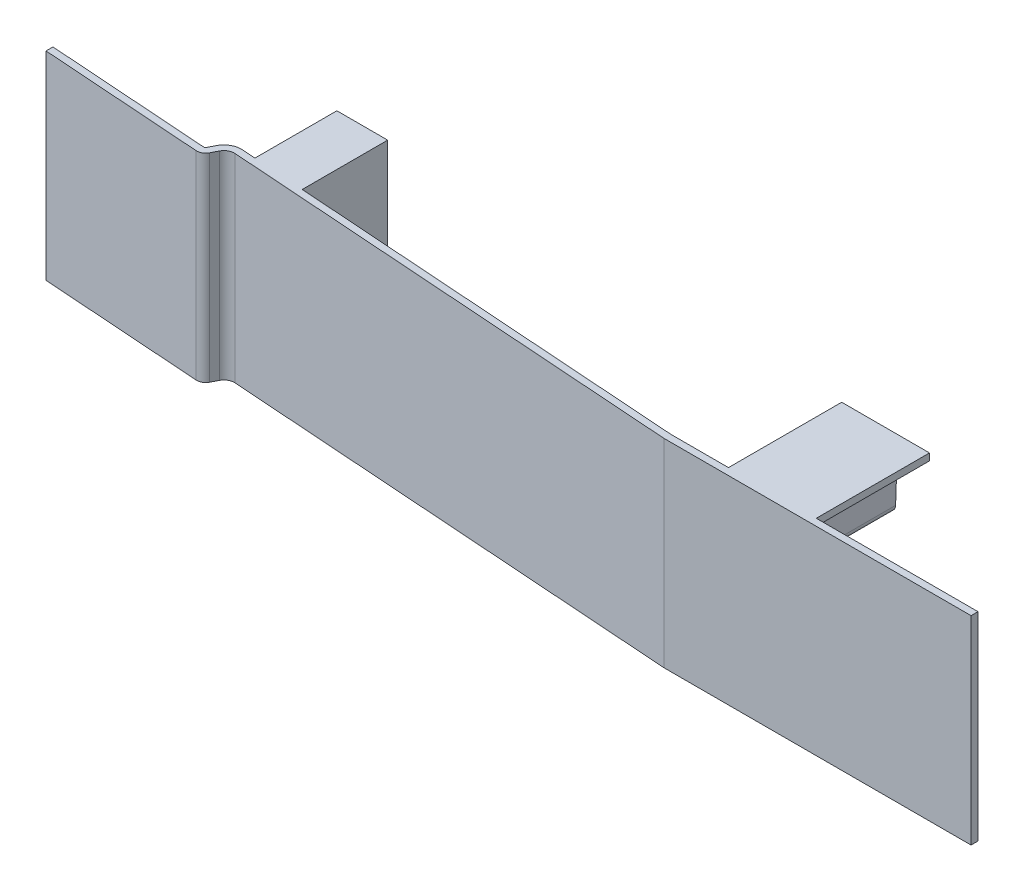
from build123d import *

# Parameters (mm, degrees)
EXTRUSION1_DEPTH      = 43
EXTRUSION1_DEPTH_BACK = 43
EXTRUSION2_DEPTH      = 49


with BuildPart() as part:
    # Esquisse1 → Extrusion1 (new, two sides: drawn at the far end of the back side and taken through both)
    with BuildSketch(Plane(origin=(0, 0, 0), x_dir=(1, 0, 0), z_dir=(0, 1, 0)).offset(-EXTRUSION1_DEPTH_BACK)):
        with BuildLine():
            Line((43, 0), (-90, 0))
            Line((-90, 0), (-289.512810052, 13.951294749))
            ThreePointArc((-289.512810052, 13.951294749), (-292.060894193, 13.374722173), (-293.867473702, 11.487544597))
            Line((-293.867473702, 11.487544597), (-295.268797801, 8.737291199))
            ThreePointArc((-295.268797801, 8.737291199), (-296.837030139, 7.099094327), (-299.048938294, 6.59859061))
            Line((-299.048938294, 6.59859061), (-368.878421812, 11.481543773))
            Line((-368.878421812, 11.481543773), (-368.878421812, 14.488869467))
            Line((-368.878421812, 14.488869467), (-298.839668873, 9.591282761))
            ThreePointArc((-298.839668873, 9.591282761), (-298.314300819, 9.710161415), (-297.941817373, 10.099262699))
            Line((-297.941817373, 10.099262699), (-296.540493275, 12.849516097))
            ThreePointArc((-296.540493275, 12.849516097), (-293.538164873, 15.985789261), (-289.303540631, 16.9439869))
            Line((-289.303540631, 16.9439869), (-283.5, 16.538163805))
            Line((-283.5, 16.538163805), (-283.5, 52))
            Line((-283.5, 52), (-261.5, 52))
            Line((-261.5, 52), (-261.5, 14.999773943))
            Line((-261.5, 14.999773943), (-89.895237692, 3))
            Line((-89.895237692, 3), (43, 3))
            Line((43, 3), (43, 0))
        make_face()
    extrude(amount=EXTRUSION1_DEPTH + EXTRUSION1_DEPTH_BACK)

    # Esquisse2 → Extrusion2 (add)
    with BuildSketch(Plane(origin=(0, 0, -3), x_dir=(-1, 0, 0), z_dir=(0, 0, -1))):
        with BuildLine():
            Line((27, 43), (27, 40))
            Line((27, 40), (36, 40))
            ThreePointArc((36, 40), (39.473291852, 38.596699002), (40.996954135, 35.174497484))
            Line((40.996954135, 35.174497484), (41.666542342, 16))
            ThreePointArc((41.666542342, 16), (42.545221998, 13.878679656), (44.666542342, 13))
            Line((44.666542342, 13), (56.368378428, 13))
            ThreePointArc((56.368378428, 13), (58.459244141, 13.909134287), (59.368378428, 16))
            Line((59.368378428, 16), (60.003045865, 34.174497484))
            ThreePointArc((60.003045865, 34.174497484), (61.526708148, 37.596699002), (65, 39))
            Line((65, 39), (65, 43))
            Line((65, 43), (27, 43))
        make_face()
    extrude(amount=EXTRUSION2_DEPTH)


solid = part.part
